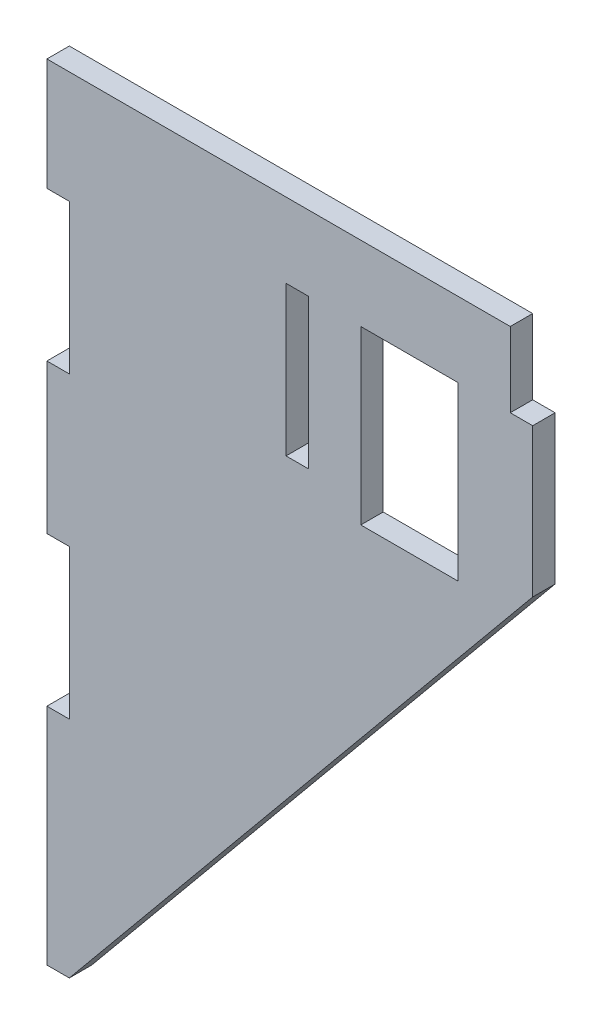
from build123d import *

# Parameters (mm, degrees)
SKETCH1_W           = 13
SKETCH1_H           = 23
SKETCH1_W_2         = 3
SKETCH1_H_2         = 20
BOSS_EXTRUDE1_DEPTH = 3


with BuildPart() as part:
    # Sketch1 → Boss-Extrude1 (new body)
    with BuildSketch(Plane.XY):
        Polygon((-3, 70), (-3, 50), (0, 50), (0, 30), (-3, 30), (-3, 0), (0, 0), (62, 75.151515152), (62, 95), (59, 95), (59, 105), (15, 105), (-3, 105), (-3, 90), (0, 90), (0, 70), align=None)
        with Locations((45.5, 83.5)):
            Rectangle(SKETCH1_W, SKETCH1_H, mode=Mode.SUBTRACT)
        with Locations((30.5, 85)):
            Rectangle(SKETCH1_W_2, SKETCH1_H_2, mode=Mode.SUBTRACT)
    extrude(amount=BOSS_EXTRUDE1_DEPTH)


solid = part.part
